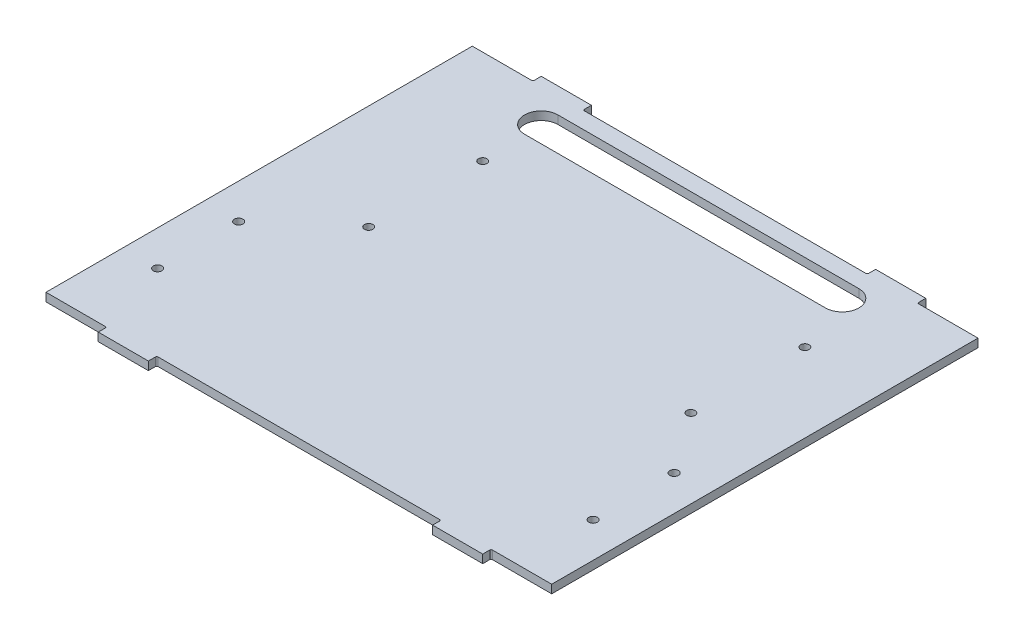
from build123d import *

# Parameters (mm, degrees)
SKETCH1_W           = 192.0875
SKETCH1_H           = 161.925
BOSS_EXTRUDE1_DEPTH = 3.175
SKETCH2_W           = 19.05
SKETCH2_H           = 3.175
BOSS_EXTRUDE2_DEPTH = 3.175
CUT_EXTRUDE1_DEPTH  = 128.724709611
FILLET1_R           = 0.508
CUT_EXTRUDE2_REACH  = 129.725
SKETCH4_R           = 1.6256
CUT_EXTRUDE3_REACH  = 129.725
SKETCH5_R           = 1.6


with BuildPart() as part:
    # Sketch1 → Boss-Extrude1 (new body)
    with BuildSketch(Plane(origin=(0, 0, 0), x_dir=(1, 0, 0), z_dir=(0, 1, 0))):
        Rectangle(SKETCH1_W, SKETCH1_H)
    extrude(amount=BOSS_EXTRUDE1_DEPTH)

    # Sketch2 → Boss-Extrude2 (add)
    with BuildSketch(Plane(origin=(0, 3.175, 0), x_dir=(1, 0, 0), z_dir=(0, 1, 0))):
        with Locations((-63.5, 82.55)):
            Rectangle(SKETCH2_W, SKETCH2_H)
        with Locations((63.5, 82.55)):
            Rectangle(SKETCH2_W, SKETCH2_H)
        with Locations((-63.5, -82.55)):
            Rectangle(SKETCH2_W, SKETCH2_H)
        with Locations((63.5, -82.55)):
            Rectangle(SKETCH2_W, SKETCH2_H)
    extrude(amount=-BOSS_EXTRUDE2_DEPTH)

    # Sketch3 → Cut-Extrude1 (cut, through all)
    with BuildSketch(Plane(origin=(0, 3.175, 0), x_dir=(1, 0, 0), z_dir=(0, 1, 0))):
        with BuildLine():
            Line((-57.15, 74.6125), (57.15, 74.6125))
            ThreePointArc((57.15, 74.6125), (63.5, 68.2625), (57.15, 61.9125))
            Line((57.15, 61.9125), (-57.15, 61.9125))
            ThreePointArc((-57.15, 61.9125), (-63.5, 68.2625), (-57.15, 74.6125))
        make_face()
    extrude(amount=-CUT_EXTRUDE1_DEPTH, mode=Mode.SUBTRACT)

    # Fillet1
    fillet1_edges = [part.edges().sort_by_distance(p)[0] for p in [
        (73.025, 1.5875, 80.9625),
        (53.975, 1.5875, 80.9625),
        (-53.975, 1.5875, 80.9625),
        (-73.025, 1.5875, 80.9625),
        (53.975, 1.5875, -80.9625),
        (73.025, 1.5875, -80.9625),
        (-53.975, 1.5875, -80.9625),
        (-73.025, 1.5875, -80.9625),
    ]]
    fillet(fillet1_edges, radius=FILLET1_R)

    # Sketch4 → Cut-Extrude2 (cut, up to next)
    with BuildSketch(Plane.XZ, mode=Mode.PRIVATE) as cut_extrude2_sk1:
        with Locations(Location((-82.7024, 51.9049, 0), (0, 0, 270))):
            Circle(SKETCH4_R)
    cut_extrude2_tool1 = extrude(cut_extrude2_sk1.sketch, amount=-CUT_EXTRUDE2_REACH, mode=Mode.PRIVATE) & part.part
    # Sketch4 → Cut-Extrude2 (cut, up to next)
    with BuildSketch(Plane.XZ, mode=Mode.PRIVATE) as cut_extrude2_sk2:
        with Locations(Location((-82.7024, 21.1201, 0), (0, 0, 270))):
            Circle(SKETCH4_R)
    cut_extrude2_tool2 = extrude(cut_extrude2_sk2.sketch, amount=-CUT_EXTRUDE2_REACH, mode=Mode.PRIVATE) & part.part
    # Sketch4 → Cut-Extrude2 (cut, up to next)
    with BuildSketch(Plane.XZ, mode=Mode.PRIVATE) as cut_extrude2_sk3:
        with Locations(Location((82.7024, 21.1201, 0), (0, 0, 270))):
            Circle(SKETCH4_R)
    cut_extrude2_tool3 = extrude(cut_extrude2_sk3.sketch, amount=-CUT_EXTRUDE2_REACH, mode=Mode.PRIVATE) & part.part
    # Sketch4 → Cut-Extrude2 (cut, up to next)
    with BuildSketch(Plane.XZ, mode=Mode.PRIVATE) as cut_extrude2_sk4:
        with Locations(Location((82.7024, 51.9049, 0), (0, 0, 270))):
            Circle(SKETCH4_R)
    cut_extrude2_tool4 = extrude(cut_extrude2_sk4.sketch, amount=-CUT_EXTRUDE2_REACH, mode=Mode.PRIVATE) & part.part
    add(cut_extrude2_tool1.solids().sort_by_distance((-82.7024, 0, 51.9049))[0], mode=Mode.SUBTRACT)
    add(cut_extrude2_tool2.solids().sort_by_distance((-82.7024, 0, 21.1201))[0], mode=Mode.SUBTRACT)
    add(cut_extrude2_tool3.solids().sort_by_distance((82.7024, 0, 21.1201))[0], mode=Mode.SUBTRACT)
    add(cut_extrude2_tool4.solids().sort_by_distance((82.7024, 0, 51.9049))[0], mode=Mode.SUBTRACT)

    # Sketch5 → Cut-Extrude3 (cut, up to next)
    with BuildSketch(Plane(origin=(0, 3.175, 0), x_dir=(1, 0, 0), z_dir=(0, 1, 0)), mode=Mode.PRIVATE) as cut_extrude3_sk1:
        with Locations(Location((66.1333, 1.8125, 0), (0, 0, 270))):
            Circle(SKETCH5_R)
    cut_extrude3_tool1 = extrude(cut_extrude3_sk1.sketch, amount=-CUT_EXTRUDE3_REACH, mode=Mode.PRIVATE) & part.part
    # Sketch5 → Cut-Extrude3 (cut, up to next)
    with BuildSketch(Plane(origin=(0, 3.175, 0), x_dir=(1, 0, 0), z_dir=(0, 1, 0)), mode=Mode.PRIVATE) as cut_extrude3_sk2:
        with Locations(Location((66.1333, 45.1125, 0), (0, 0, 270))):
            Circle(SKETCH5_R)
    cut_extrude3_tool2 = extrude(cut_extrude3_sk2.sketch, amount=-CUT_EXTRUDE3_REACH, mode=Mode.PRIVATE) & part.part
    # Sketch5 → Cut-Extrude3 (cut, up to next)
    with BuildSketch(Plane(origin=(0, 3.175, 0), x_dir=(1, 0, 0), z_dir=(0, 1, 0)), mode=Mode.PRIVATE) as cut_extrude3_sk3:
        with Locations(Location((-56.25, 45.1125, 0), (0, 0, 270))):
            Circle(SKETCH5_R)
    cut_extrude3_tool3 = extrude(cut_extrude3_sk3.sketch, amount=-CUT_EXTRUDE3_REACH, mode=Mode.PRIVATE) & part.part
    # Sketch5 → Cut-Extrude3 (cut, up to next)
    with BuildSketch(Plane(origin=(0, 3.175, 0), x_dir=(1, 0, 0), z_dir=(0, 1, 0)), mode=Mode.PRIVATE) as cut_extrude3_sk4:
        with Locations(Location((-56.25, 1.8125, 0), (0, 0, 270))):
            Circle(SKETCH5_R)
    cut_extrude3_tool4 = extrude(cut_extrude3_sk4.sketch, amount=-CUT_EXTRUDE3_REACH, mode=Mode.PRIVATE) & part.part
    add(cut_extrude3_tool1.solids().sort_by_distance((66.1333, 3.175, -1.8125))[0], mode=Mode.SUBTRACT)
    add(cut_extrude3_tool2.solids().sort_by_distance((66.1333, 3.175, -45.1125))[0], mode=Mode.SUBTRACT)
    add(cut_extrude3_tool3.solids().sort_by_distance((-56.25, 3.175, -45.1125))[0], mode=Mode.SUBTRACT)
    add(cut_extrude3_tool4.solids().sort_by_distance((-56.25, 3.175, -1.8125))[0], mode=Mode.SUBTRACT)


solid = part.part
